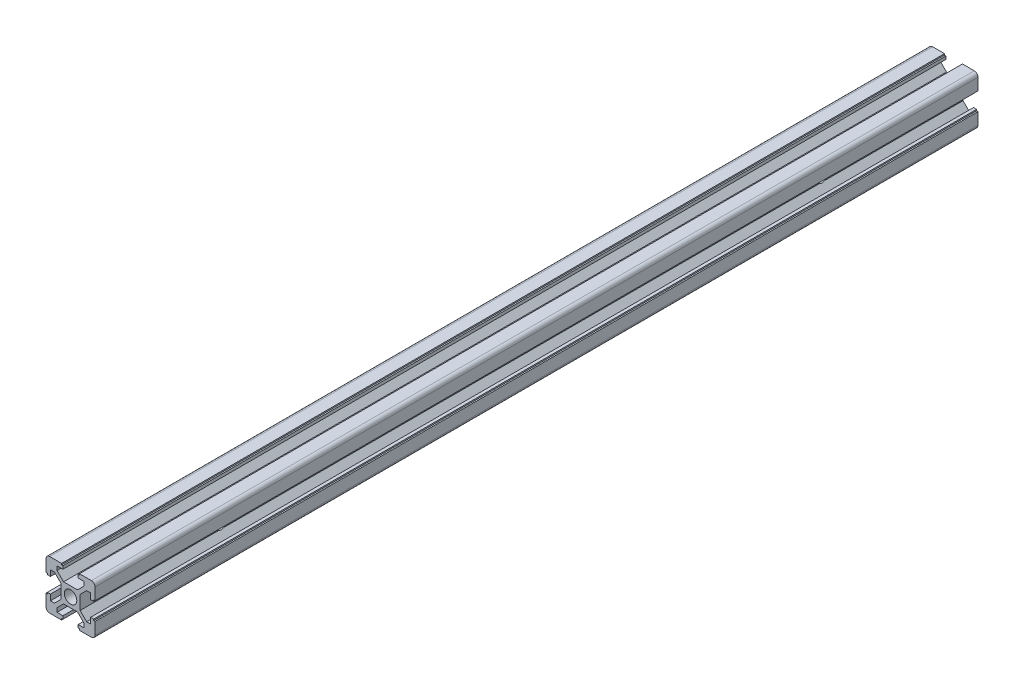
from build123d import *

# Parameters (mm, degrees)
SKETCH_2_R          = 2.55
EXTRUDE_1_DEPTH     = 360
SKETCH_3_R          = 3
CUT_EXTRUDE_1_DEPTH = 361.693775937


with BuildPart() as part:
    # 草图2 → 凸台-拉伸1 (new body)
    with BuildSketch(Plane.XY):
        with BuildLine():
            Line((-3.9, 2.839339828), (-6.560660172, 5.5))
            Line((-6.560660172, 5.5), (-8.2, 5.5))
            Line((-8.2, 5.5), (-8.2, 3.1))
            Line((-8.2, 3.1), (-9.45, 3.1))
            Line((-9.45, 3.1), (-9.45, 3.65))
            Line((-9.45, 3.65), (-10, 3.65))
            Line((-10, 3.65), (-10, 8.5))
            ThreePointArc((-10, 8.5), (-9.560660172, 9.560660172), (-8.5, 10))
            Line((-8.5, 10), (-3.65, 10))
            Line((-3.65, 10), (-3.65, 9.45))
            Line((-3.65, 9.45), (-3.1, 9.45))
            Line((-3.1, 9.45), (-3.1, 8.2))
            Line((-3.1, 8.2), (-5.5, 8.2))
            Line((-5.5, 8.2), (-5.5, 6.560660172))
            Line((-5.5, 6.560660172), (-2.839339828, 3.9))
            Line((-2.839339828, 3.9), (2.839339828, 3.9))
            Line((2.839339828, 3.9), (5.5, 6.560660172))
            Line((5.5, 6.560660172), (5.5, 8.2))
            Line((5.5, 8.2), (3.1, 8.2))
            Line((3.1, 8.2), (3.1, 9.45))
            Line((3.1, 9.45), (3.65, 9.45))
            Line((3.65, 9.45), (3.65, 10))
            Line((3.65, 10), (8.5, 10))
            ThreePointArc((8.5, 10), (9.560660172, 9.560660172), (10, 8.5))
            Line((10, 8.5), (10, 3.65))
            Line((10, 3.65), (9.45, 3.65))
            Line((9.45, 3.65), (9.45, 3.1))
            Line((9.45, 3.1), (8.2, 3.1))
            Line((8.2, 3.1), (8.2, 5.5))
            Line((8.2, 5.5), (6.560660172, 5.5))
            Line((6.560660172, 5.5), (3.9, 2.839339828))
            Line((3.9, 2.839339828), (3.9, -2.839339828))
            Line((3.9, -2.839339828), (6.560660172, -5.5))
            Line((6.560660172, -5.5), (8.2, -5.5))
            Line((8.2, -5.5), (8.2, -3.1))
            Line((8.2, -3.1), (9.45, -3.1))
            Line((9.45, -3.1), (9.45, -3.65))
            Line((9.45, -3.65), (10, -3.65))
            Line((10, -3.65), (10, -8.5))
            ThreePointArc((10, -8.5), (9.560660172, -9.560660172), (8.5, -10))
            Line((8.5, -10), (3.65, -10))
            Line((3.65, -10), (3.65, -9.45))
            Line((3.65, -9.45), (3.1, -9.45))
            Line((3.1, -9.45), (3.1, -8.2))
            Line((3.1, -8.2), (5.5, -8.2))
            Line((5.5, -8.2), (5.5, -6.560660172))
            Line((5.5, -6.560660172), (2.839339828, -3.9))
            Line((2.839339828, -3.9), (-2.839339828, -3.9))
            Line((-2.839339828, -3.9), (-5.5, -6.560660172))
            Line((-5.5, -6.560660172), (-5.5, -8.2))
            Line((-5.5, -8.2), (-3.1, -8.2))
            Line((-3.1, -8.2), (-3.1, -9.45))
            Line((-3.1, -9.45), (-3.65, -9.45))
            Line((-3.65, -9.45), (-3.65, -10))
            Line((-3.65, -10), (-8.5, -10))
            ThreePointArc((-8.5, -10), (-9.560660172, -9.560660172), (-10, -8.5))
            Line((-10, -8.5), (-10, -3.65))
            Line((-10, -3.65), (-9.45, -3.65))
            Line((-9.45, -3.65), (-9.45, -3.1))
            Line((-9.45, -3.1), (-8.2, -3.1))
            Line((-8.2, -3.1), (-8.2, -5.5))
            Line((-8.2, -5.5), (-6.560660172, -5.5))
            Line((-6.560660172, -5.5), (-3.9, -2.839339828))
            Line((-3.9, -2.839339828), (-3.9, 2.839339828))
        make_face()
        with Locations(Location((0, 0, 0), (0, 0, 180))):
            Circle(SKETCH_2_R, mode=Mode.SUBTRACT)
    extrude(amount=EXTRUDE_1_DEPTH)

    # 草图3 → 切除-拉伸1 (cut, through all)
    with BuildSketch(Plane(origin=(10, 0, 0), x_dir=(0, 0, -1), z_dir=(1, 0, 0))):
        with Locations(Location((-57.5, 0, 0), (0, 0, 71.16400384))):
            Circle(SKETCH_3_R)
        with Locations(Location((-302.5, 0, 0), (0, 0, 108.835996159))):
            Circle(SKETCH_3_R)
    extrude(amount=-CUT_EXTRUDE_1_DEPTH, mode=Mode.SUBTRACT)


solid = part.part
